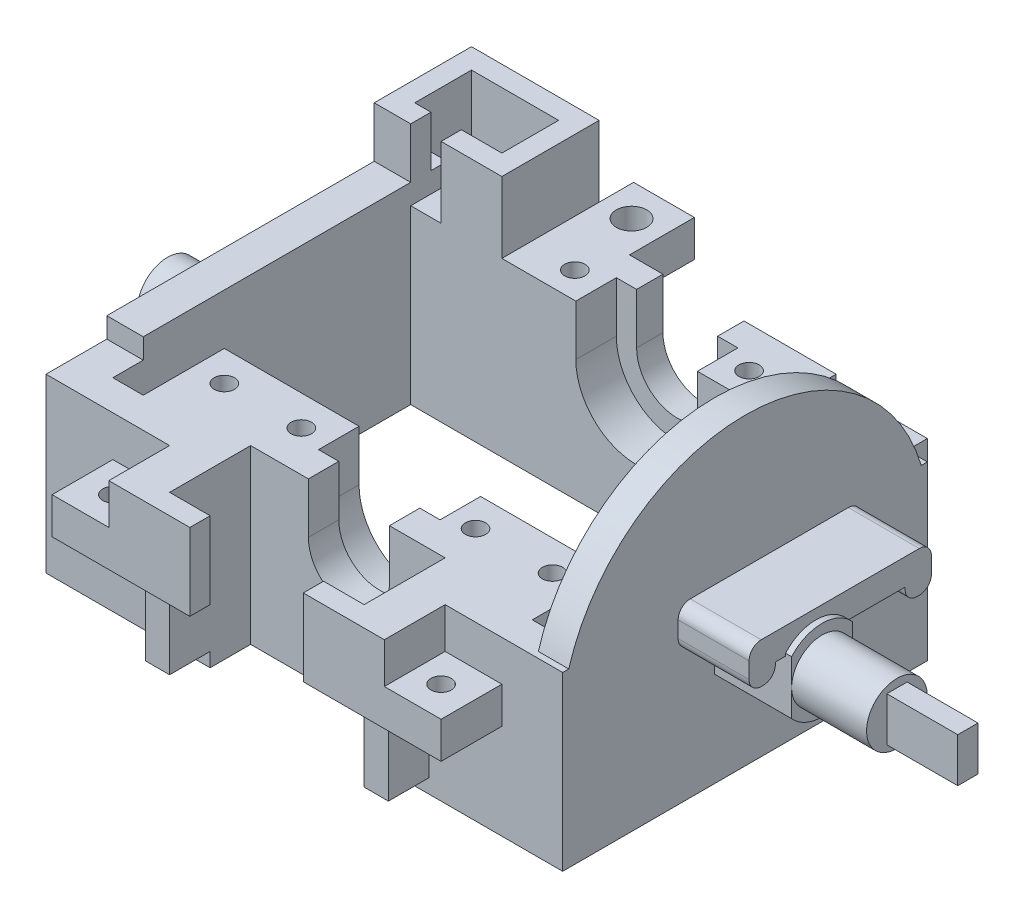
from build123d import *

# Parameters (mm, degrees)
SKETCH_1_R               = 0.5
EXTRUDE_1_DEPTH          = 8.5
SKETCH_2_W               = 3.3
SKETCH_2_H               = 4
SKETCH_2_R               = 0.5
EXTRUDE_2_DEPTH          = 3
EXTRUDE_3_DEPTH          = 3.8
SKETCH_4_W               = 2.8
SKETCH_4_H               = 3
SKETCH_4_R               = 0.5
EXTRUDE_4_DEPTH          = 1.8
SKETCH_5_W               = 1.2
SKETCH_5_H               = 2
EXTRUDE_5_DEPTH          = 4
SKETCH_6_W               = 1.8
SKETCH_6_H               = 15
EXTRUDE_6_DEPTH          = 1
EXTRUDE_7_DEPTH          = 3.5
EXTRUDE_7_DEPTH_BACK     = 4.5
SKETCH_8_W               = 4.3
SKETCH_8_H               = 2
EXTRUDE_8_DEPTH          = 1
EXTRUDE_9_DEPTH          = 1.5
SKETCH_10_R              = 0.75
EXTRUDE_10_DEPTH         = 1.8
SKETCH_12_W              = 3
SKETCH_12_H              = 1.8
EXTRUDE_11_DEPTH         = 3
SKETCH_13_R              = 0.75
CUT_EXTRUDE_1_DEPTH      = 3
SKETCH_14_R              = 0.5
CUT_EXTRUDE_2_DEPTH      = 3
CUT_EXTRUDE_3_DEPTH      = 7
CUT_EXTRUDE_4_DEPTH      = 36.146123542
CUT_EXTRUDE_5_DEPTH      = 12.7
CUT_EXTRUDE_5_DEPTH_BACK = 2
SKETCH_18_W              = 2
SKETCH_18_H              = 1.2
CUT_EXTRUDE_6_DEPTH      = 2.3
EXTRUDE_12_DEPTH         = 1.5
SKETCH_22_R              = 1.5
EXTRUDE_13_DEPTH         = 3
SKETCH_23_R              = 2
EXTRUDE_14_DEPTH         = 0.5
EXTRUDE_START            = 7.5
SKETCH_24_R              = 1.5
EXTRUDE_15_DEPTH         = 7.5
EXTRUDE_16_DEPTH         = 3.5
EXTRUDE_17_DEPTH         = 3.5
EXTRUDE_START_2          = 3.8
EXTRUDE_18_DEPTH         = 3.8


with BuildPart() as part:
    # 草图1 → 凸台-拉伸1 (new body)
    with BuildSketch(Plane(origin=(0, 0, 0), x_dir=(1, 0, 0), z_dir=(0, 1, 0))):
        Polygon((25.5, 0), (25.5, 18), (0, 18), (0, 0), (8.1, 0), (8.1, 2), (17.7, 2), (17.7, 0), align=None)
        with Locations(Location((8.6, 4, 0), (0, 0, 270))):
            Circle(SKETCH_1_R, mode=Mode.SUBTRACT)
        with Locations(Location((17.2, 4, 0), (0, 0, 270))):
            Circle(SKETCH_1_R, mode=Mode.SUBTRACT)
        Polygon((24, 1.5), (19.2, 1.5), (19.2, 5.5), (12.9, 5.5), (6.6, 5.5), (6.6, 1.5), (1.8, 1.5), (1.8, 16.2), (21, 16.2), (21, 11.5), (24, 11.5), align=None, mode=Mode.SUBTRACT)
    extrude(amount=EXTRUDE_1_DEPTH)

    # 草图2 → 凸台-拉伸2 (add)
    # profile 1 of 2: a face of its own
    with BuildSketch(Plane(origin=(0, 8.5, 0), x_dir=(1, 0, 0), z_dir=(0, 1, 0))):
        with Locations((4.95, 3.5)):
            Rectangle(SKETCH_2_W, SKETCH_2_H)
        with Locations(Location((4.8, 4, 0), (0, 0, 270))):
            Circle(SKETCH_2_R, mode=Mode.SUBTRACT)
    # profile 2 of 2: a face of its own
    with BuildSketch(Plane(origin=(0, 8.5, 0), x_dir=(1, 0, 0), z_dir=(0, 1, 0))):
        with Locations((20.85, 3.5)):
            Rectangle(SKETCH_2_W, SKETCH_2_H)
        with Locations(Location((21, 4, 0), (0, 0, 270))):
            Circle(SKETCH_2_R, mode=Mode.SUBTRACT)
    extrude(amount=-EXTRUDE_2_DEPTH)

    # 草图3 → 凸台-拉伸3 (add)
    with BuildSketch(Plane(origin=(0, 8.5, 0), x_dir=(1, 0, 0), z_dir=(0, 1, 0))):
        Polygon((17.7, 0), (17.7, -2), (15.7, -2), (15.7, -3), (17.7, -3), (19.7, -3), (19.7, 0), align=None)
        Polygon((8.1, 0), (6.1, 0), (6.1, -3), (8.1, -3), (10.1, -3), (10.1, -2), (8.1, -2), align=None)
    extrude(amount=-EXTRUDE_3_DEPTH)

    # 草图4 → 凸台-拉伸4 (add)
    # profile 1 of 2: a face of its own
    with BuildSketch(Plane.XZ.offset(-4.7)):
        with Locations((21.1, 1.5)):
            Rectangle(SKETCH_4_W, SKETCH_4_H)
        with Locations(Location((21, 1.5, 0), (0, 0, 270))):
            Circle(SKETCH_4_R, mode=Mode.SUBTRACT)
    # profile 2 of 2: a face of its own
    with BuildSketch(Plane.XZ.offset(-4.7)):
        with Locations((4.7, 1.5)):
            Rectangle(SKETCH_4_W, SKETCH_4_H)
        with Locations(Location((4.8, 1.5, 0), (0, 0, 270))):
            Circle(SKETCH_4_R, mode=Mode.SUBTRACT)
    extrude(amount=-EXTRUDE_4_DEPTH)

    # 草图5 → 凸台-拉伸5 (add)
    with BuildSketch(Plane.XZ.offset(-4.7)):
        with Locations((7.5, 1)):
            Rectangle(SKETCH_5_W, SKETCH_5_H)
        with Locations((18.3, 1)):
            Rectangle(SKETCH_5_W, SKETCH_5_H)
    extrude(amount=EXTRUDE_5_DEPTH)

    # 草图6 → 凸台-拉伸6 (add)
    with BuildSketch(Plane(origin=(0, 8.5, 0), x_dir=(1, 0, 0), z_dir=(0, 1, 0))):
        with Locations((0.9, 10.5)):
            Rectangle(SKETCH_6_W, SKETCH_6_H)
    extrude(amount=EXTRUDE_6_DEPTH)

    # 草图7 → 凸台-拉伸7 (add, two sides: drawn at the far end of the back side and taken through both)
    with BuildSketch(Plane(origin=(0, 8.5, 0), x_dir=(1, 0, 0), z_dir=(0, 1, 0)).offset(-EXTRUDE_7_DEPTH_BACK)):
        Polygon((0, 18), (0, 21), (6.3, 21), (6.3, 16.2), (3.3, 16.2), (3.3, 17.2), (5.3, 17.2), (5.3, 20), (1, 20), (1, 17.2), (1.8, 17.2), (1.8, 16.2), (0, 16.2), align=None)
    extrude(amount=EXTRUDE_7_DEPTH + EXTRUDE_7_DEPTH_BACK)

    # 草图8 → 凸台-拉伸8 (add)
    with BuildSketch(Plane.XZ.offset(-4)):
        with Locations((3.15, -19)):
            Rectangle(SKETCH_8_W, SKETCH_8_H)
    extrude(amount=-EXTRUDE_8_DEPTH)

    # 草图9 → 凸台-拉伸9 (add)
    with BuildSketch(Plane(origin=(0, 0, -18), x_dir=(-1, 0, 0), z_dir=(0, 0, -1))):
        with BuildLine():
            Line((-10.95, 8.5), (-10.95, 6))
            ThreePointArc((-10.95, 6), (-12.95, 4), (-14.95, 6))
            Line((-14.95, 6), (-14.95, 8.5))
            Line((-14.95, 8.5), (-19.5, 8.5))
            Line((-19.5, 8.5), (-19.5, 3.5))
            Line((-19.5, 3.5), (-16.691657387, 3.5))
            ThreePointArc((-16.691657387, 3.5), (-12.95, 1.5), (-9.208342613, 3.5))
            Line((-9.208342613, 3.5), (-6.3, 3.5))
            Line((-6.3, 3.5), (-6.3, 8.5))
            Line((-6.3, 8.5), (-10.95, 8.5))
        make_face()
    extrude(amount=EXTRUDE_9_DEPTH)

    # 草图10 → 凸台-拉伸10 (add)
    with BuildSketch(Plane(origin=(0, 8.5, 0), x_dir=(1, 0, 0), z_dir=(0, 1, 0))):
        Polygon((6.3, 22.7), (6.3, 19.5), (9.3, 19.5), (9.3, 21.1), (9.3, 22.7), align=None)
        with Locations(Location((7.8, 21.1, 0), (0, 0, 270))):
            Circle(SKETCH_10_R, mode=Mode.SUBTRACT)
    extrude(amount=-EXTRUDE_10_DEPTH)

    # 草图12 → 凸台-拉伸11 (add)
    with BuildSketch(Plane(origin=(0, 0, -18), x_dir=(-1, 0, 0), z_dir=(0, 0, -1))):
        with Locations((-21, 5.6)):
            Rectangle(SKETCH_12_W, SKETCH_12_H)
    extrude(amount=EXTRUDE_11_DEPTH)

    # 草图13 → 切除-拉伸1 (cut)
    with BuildSketch(Plane(origin=(0, 6.5, 0), x_dir=(1, 0, 0), z_dir=(0, 1, 0))):
        with Locations(Location((21, 19.5, 0), (0, 0, 270))):
            Circle(SKETCH_13_R)
    extrude(amount=-CUT_EXTRUDE_1_DEPTH, mode=Mode.SUBTRACT)

    # 草图14 → 切除-拉伸2 (cut)
    with BuildSketch(Plane(origin=(0, 8.5, 0), x_dir=(1, 0, 0), z_dir=(0, 1, 0))):
        with Locations(Location((17.2, 17.5, 0), (0, 0, 270))):
            Circle(SKETCH_14_R)
        with Locations(Location((8.6, 17.5, 0), (0, 0, 270))):
            Circle(SKETCH_14_R)
    extrude(amount=-CUT_EXTRUDE_2_DEPTH, mode=Mode.SUBTRACT)

    # 草图15 → 切除-拉伸3 (cut)
    with BuildSketch(Plane(origin=(0, 8.5, 0), x_dir=(1, 0, 0), z_dir=(0, 1, 0))):
        Polygon((21, 15.7), (21, 12.7), (24, 12.7), (24, 16.7), (22, 16.7), (22, 15.7), align=None)
    extrude(amount=-CUT_EXTRUDE_3_DEPTH, mode=Mode.SUBTRACT)

    # 草图16 → 切除-拉伸4 (cut, through all)
    with BuildSketch(Plane(origin=(0, 0, -18), x_dir=(-1, 0, 0), z_dir=(0, 0, -1))):
        with BuildLine():
            Line((-14.95, 8.5), (-10.95, 8.5))
            Line((-10.95, 8.5), (-10.95, 6))
            ThreePointArc((-10.95, 6), (-12.95, 4), (-14.95, 6))
            Line((-14.95, 6), (-14.95, 8.5))
        make_face()
    extrude(amount=-CUT_EXTRUDE_4_DEPTH, mode=Mode.SUBTRACT)

    # 草图17 → 切除-拉伸5 (cut, two sides: drawn at the far end of the back side and taken through both)
    with BuildSketch(Plane.XY.offset(-16.2).offset(-CUT_EXTRUDE_5_DEPTH_BACK)):
        with BuildLine():
            Line((15.95, 6), (15.95, 8.5))
            Line((15.95, 8.5), (9.95, 8.5))
            Line((9.95, 8.5), (9.95, 6))
            ThreePointArc((9.95, 6), (12.95, 3), (15.95, 6))
        make_face()
    extrude(amount=CUT_EXTRUDE_5_DEPTH + CUT_EXTRUDE_5_DEPTH_BACK, mode=Mode.SUBTRACT)

    # 草图18 → 切除-拉伸6 (cut)
    with BuildSketch(Plane(origin=(0, 8.5, 0), x_dir=(1, 0, 0), z_dir=(0, 1, 0))):
        with Locations((23, 12.1)):
            Rectangle(SKETCH_18_W, SKETCH_18_H)
    extrude(amount=-CUT_EXTRUDE_6_DEPTH, mode=Mode.SUBTRACT)

    # 草图19 → 凸台-拉伸12 (add)
    with BuildSketch(Plane(origin=(25.5, 0, 0), x_dir=(0, 0, -1), z_dir=(1, 0, 0))):
        with BuildLine():
            Line((0.30001254, 8.5), (17.69998746, 8.5))
            ThreePointArc((17.69998746, 8.5), (9, 14.998364198), (0.30001254, 8.5))
        make_face()
    extrude(amount=-EXTRUDE_12_DEPTH)

    # 草图22 → 凸台-拉伸13 (add)
    with BuildSketch(Plane.ZY):
        with Locations(Location((-9, 6, 0), (0, 0, 180))):
            Circle(SKETCH_22_R)
    extrude(amount=EXTRUDE_13_DEPTH)

    # 草图23 → 凸台-拉伸14 (add)
    with BuildSketch(Plane.ZY):
        with Locations(Location((-9, 6, 0), (0, 0, 180))):
            Circle(SKETCH_23_R)
    extrude(amount=EXTRUDE_14_DEPTH)

    # 草图24 → 凸台-拉伸15 (add)
    with BuildSketch(Plane(origin=(25.5, 0, 0), x_dir=(0, 0, -1), z_dir=(1, 0, 0)).offset(EXTRUDE_START)):
        with Locations(Location((9, 6, 0), (0, 0, 180))):
            Circle(SKETCH_24_R)
    extrude(amount=-EXTRUDE_15_DEPTH)

    # 草图25 → 凸台-拉伸16 (add)
    with BuildSketch(Plane(origin=(33, 0, 0), x_dir=(0, 0, -1), z_dir=(1, 0, 0))):
        Polygon((9.5, 6), (9.5, 7.090871211), (8.5, 7.090871211), (8.5, 4.909128789), (9.5, 4.909128789), align=None)
    extrude(amount=EXTRUDE_16_DEPTH)

    # 草图26 → 凸台-拉伸17 (add)
    with BuildSketch(Plane(origin=(25.5, 0, 0), x_dir=(0, 0, -1), z_dir=(1, 0, 0))):
        with BuildLine():
            Line((9, 8.498364198), (6.3, 8.498364198))
            ThreePointArc((6.3, 8.498364198), (5.875735931, 8.322628267), (5.7, 7.898364198))
            Line((5.7, 7.898364198), (5.7, 7.098364198))
            ThreePointArc((5.7, 7.098364198), (5.875735931, 6.674100129), (6.3, 6.498364198))
            Line((6.3, 6.498364198), (6.4, 6.498364198))
            ThreePointArc((6.4, 6.498364198), (6.824264069, 6.674100129), (7, 7.098364198))
            Line((7, 7.098364198), (7, 7.198364198))
            Line((7, 7.198364198), (13.4, 7.198364198))
            Line((13.4, 7.198364198), (13.4, 7.098364198))
            ThreePointArc((13.4, 7.098364198), (13.575735931, 6.674100129), (14, 6.498364198))
            Line((14, 6.498364198), (14.1, 6.498364198))
            ThreePointArc((14.1, 6.498364198), (14.524264069, 6.674100129), (14.7, 7.098364198))
            Line((14.7, 7.098364198), (14.7, 7.898364198))
            ThreePointArc((14.7, 7.898364198), (14.524264069, 8.322628267), (14.1, 8.498364198))
            Line((14.1, 8.498364198), (9, 8.498364198))
        make_face()
    extrude(amount=EXTRUDE_17_DEPTH)

    # 草图27 → 凸台-拉伸18 (add)
    with BuildSketch(Plane(origin=(25.5, 0, 0), x_dir=(0, 0, -1), z_dir=(1, 0, 0)).offset(EXTRUDE_START_2)):
        with BuildLine():
            Line((7.5, 6), (7.5, 7.322875656))
            ThreePointArc((7.5, 7.322875656), (9, 8), (10.5, 7.322875656))
            Line((10.5, 7.322875656), (10.5, 4.677124344))
            ThreePointArc((10.5, 4.677124344), (9, 4), (7.5, 4.677124344))
            Line((7.5, 4.677124344), (7.5, 6))
        make_face()
    extrude(amount=-EXTRUDE_18_DEPTH)


solid = part.part
